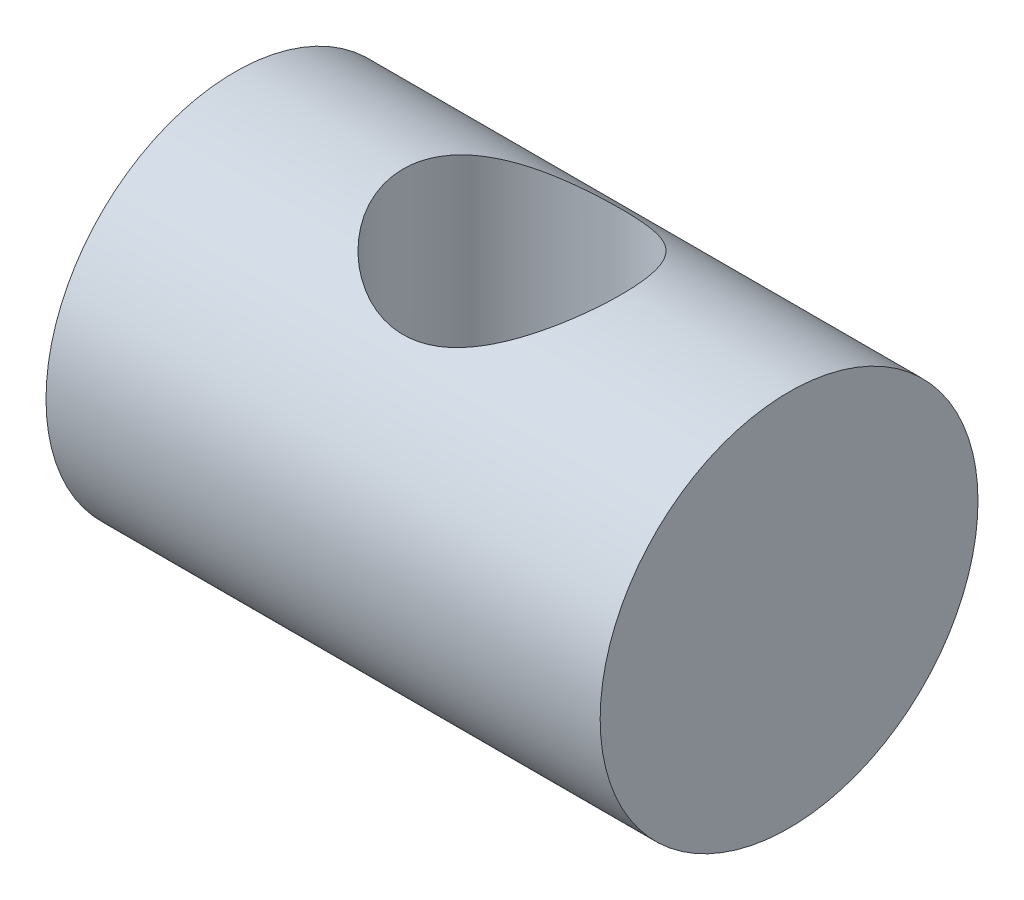
from build123d import *

# Parameters (mm, degrees)
SKETCH1_R           = 7.5
BOSS_EXTRUDE1_DEPTH = 11
SKETCH2_R           = 4.325
CUT_EXTRUDE1_DEPTH  = 16.28070679


with BuildPart() as part:
    # Sketch1 → Boss-Extrude1 (new, symmetric)
    with BuildSketch(Plane(origin=(0, 0, 0), x_dir=(0, 0, -1), z_dir=(1, 0, 0))):
        Circle(SKETCH1_R)
    extrude(amount=BOSS_EXTRUDE1_DEPTH, both=True)

    # Sketch2 → Cut-Extrude1 (cut, through all)
    with BuildSketch(Plane(origin=(0, 0, 0), x_dir=(1, 0, 0), z_dir=(0, 1, 0))):
        with Locations(Location((0, 0, 0), (0, 0, 180))):
            Circle(SKETCH2_R)
    extrude(amount=CUT_EXTRUDE1_DEPTH, mode=Mode.SUBTRACT)


solid = part.part
